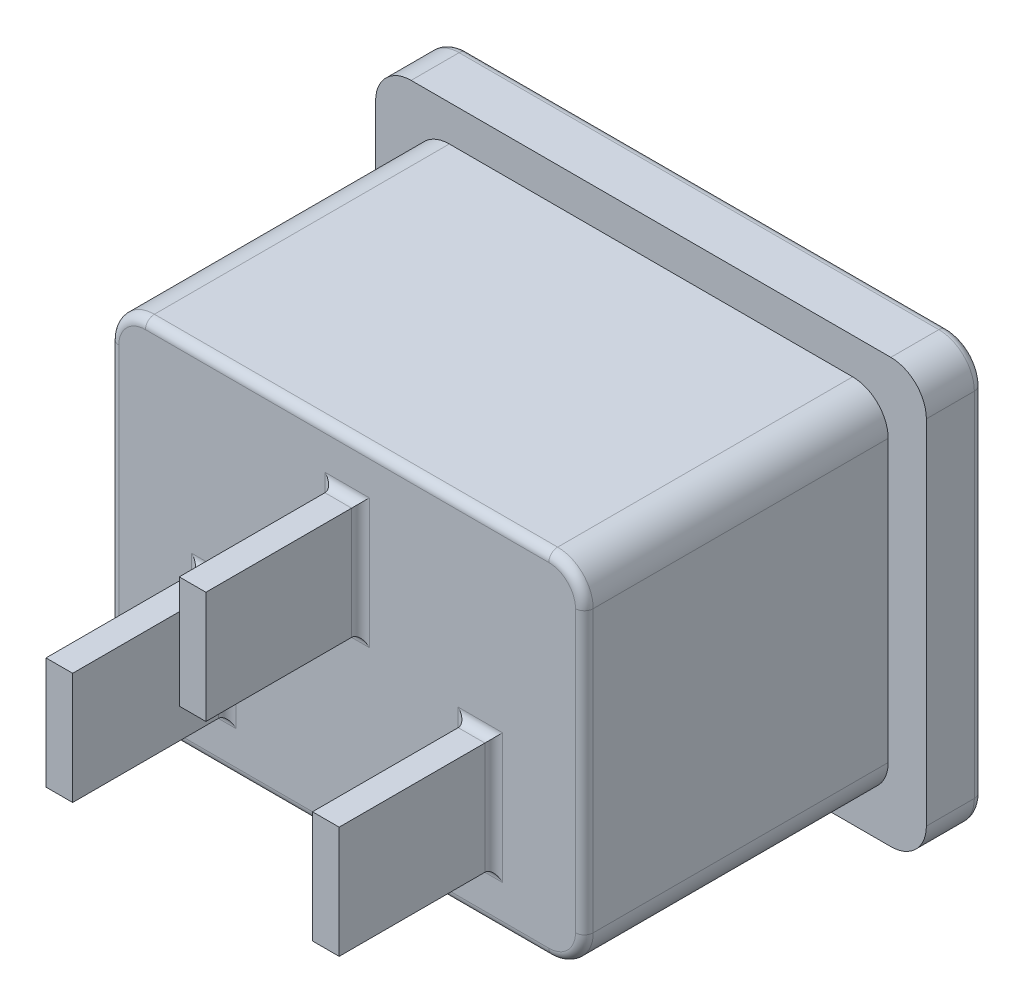
from build123d import *

# Parameters (mm, degrees)
ESQUISSE1_W             = 31
ESQUISSE1_H             = 23.85
BOSS_EXTRU_1_DEPTH      = 3.2
ESQUISSE2_W             = 26.7
ESQUISSE2_H             = 19.8
BOSS_EXTRU_2_DEPTH      = 20.3
ESQUISSE3_W             = 24
ESQUISSE3_H             = 16
ENL_V_MAT_EXTRU_1_DEPTH = 17
CHANFREIN1_SIZE         = 5
BOSS_EXTRU_3_DEPTH      = 16
BOSS_EXTRU_3_DEPTH_BACK = 12
ESQUISSE4_W             = 1.5
ESQUISSE4_H             = 6.3
CONG_1_R                = 2
CONG_2_R                = 0.5


with BuildPart() as part:
    # Esquisse1 → Boss.-Extru.1 (new body)
    with BuildSketch(Plane.XY):
        Rectangle(ESQUISSE1_W, ESQUISSE1_H)
    extrude(amount=BOSS_EXTRU_1_DEPTH)

    # Esquisse2 → Boss.-Extru.2 (add)
    with BuildSketch(Plane(origin=(0, 0, 0), x_dir=(-1, 0, 0), z_dir=(0, 0, -1))):
        Rectangle(ESQUISSE2_W, ESQUISSE2_H)
    extrude(amount=-BOSS_EXTRU_2_DEPTH)

    # Esquisse3 → Enlèv. mat.-Extru.1 (cut)
    with BuildSketch(Plane(origin=(0, 0, 0), x_dir=(-1, 0, 0), z_dir=(0, 0, -1))):
        Rectangle(ESQUISSE3_W, ESQUISSE3_H)
    extrude(amount=-ENL_V_MAT_EXTRU_1_DEPTH, mode=Mode.SUBTRACT)

    # Chanfrein1
    chanfrein1_edges = [part.edges().sort_by_distance(p)[0] for p in [
        (-12, 8, 8.5),
        (12, 8, 8.5),
    ]]
    chamfer(chanfrein1_edges, length=CHANFREIN1_SIZE)

    # Esquisse4 → Boss.-Extru.3 (add, two sides: drawn at the far end of the back side and taken through both)
    with BuildSketch(Plane(origin=(0, 0, 17), x_dir=(-1, 0, 0), z_dir=(0, 0, -1)).offset(-BOSS_EXTRU_3_DEPTH_BACK)):
        with Locations((0, 3.85)):
            Rectangle(ESQUISSE4_W, ESQUISSE4_H)
        with Locations((-7.5, -3.85)):
            Rectangle(ESQUISSE4_W, ESQUISSE4_H)
        with Locations((7.5, -3.85)):
            Rectangle(ESQUISSE4_W, ESQUISSE4_H)
    extrude(amount=BOSS_EXTRU_3_DEPTH + BOSS_EXTRU_3_DEPTH_BACK)

    # Congé1
    cong_1_edges = [part.edges().sort_by_distance(p)[0] for p in [
        (-13.35, 9.9, 11.75),
        (-13.35, -9.9, 11.75),
        (13.35, -9.9, 11.75),
        (13.35, 9.9, 11.75),
        (-12, -8, 8.5),
        (12, -8, 8.5),
        (12, 3, 8.5),
        (-7, 8, 8.5),
        (7, 8, 8.5),
        (-12, 3, 8.5),
        (15.5, -11.925, 1.6),
        (-15.5, -11.925, 1.6),
        (-15.5, 11.925, 1.6),
        (15.5, 11.925, 1.6),
    ]]
    fillet(cong_1_edges, radius=CONG_1_R)

    # Congé2
    cong_2_edges = [part.edges().sort_by_distance(p)[0] for p in [
        (-6.75, -3.85, 20.3),
        (-7.5, -7, 20.3),
        (-8.25, -3.85, 20.3),
        (15.5, 0, 0),
        (0, 8, 0),
        (-9.5, 5.5, 0),
        (-12, -1.914213562, 0),
        (0, -8, 0),
        (12, -1.914213562, 0),
        (9.5, 5.5, 0),
        (0, -11.925, 0),
        (-15.5, 0, 0),
        (0, 11.925, 0),
        (14.914213562, 11.339213562, 0),
        (-14.914213562, 11.339213562, 0),
        (-14.914213562, -11.339213562, 0),
        (14.914213562, -11.339213562, 0),
        (13.35, 0, 20.3),
        (0, -9.9, 20.3),
        (-13.35, 0, 20.3),
        (0, 9.9, 20.3),
        (12.764213562, 9.314213562, 20.3),
        (-12.764213562, 9.314213562, 20.3),
        (-12.764213562, -9.314213562, 20.3),
        (12.764213562, -9.314213562, 20.3),
        (-11.414213562, -7.414213562, 0),
        (-11.847759065, 2.93693974, 0),
        (-6.93693974, 7.847759065, 0),
        (6.93693974, 7.847759065, 0),
        (11.414213562, -7.414213562, 0),
        (11.847759065, 2.93693974, 0),
        (0, 7, 20.3),
        (0.75, 3.85, 20.3),
        (0, 0.7, 20.3),
        (-0.75, 3.85, 20.3),
        (7.5, -0.7, 20.3),
        (8.25, -3.85, 20.3),
        (7.5, -7, 20.3),
        (6.75, -3.85, 20.3),
        (-7.5, -0.7, 20.3),
    ]]
    fillet(cong_2_edges, radius=CONG_2_R)


solid = part.part
